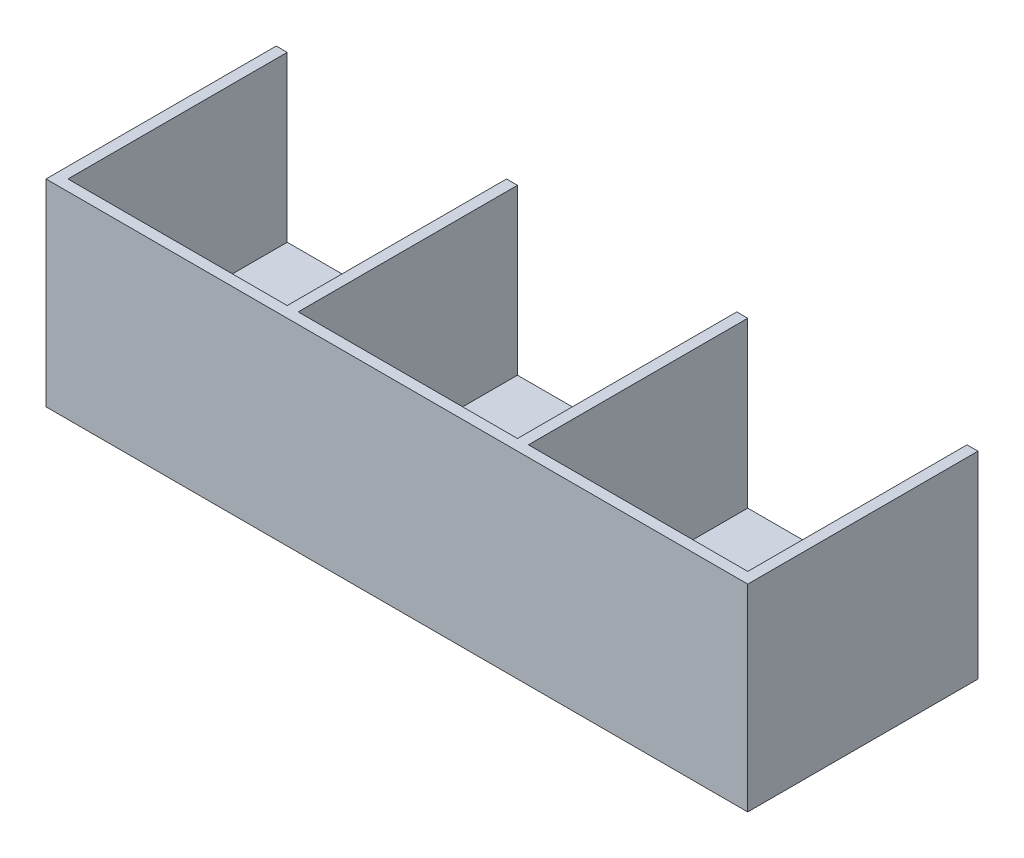
from build123d import *

# Parameters (mm, degrees)
CROQUIS1_W              = 640
CROQUIS1_H              = 220
CROQUIS1_W_2            = 200
CROQUIS1_H_2            = 200
SALIENTE_EXTRUIR1_DEPTH = 150
CROQUIS3_W              = 640
CROQUIS3_H              = 220
SALIENTE_EXTRUIR3_DEPTH = 10
CROQUIS4_R              = 4.626495545
CORTAR_EXTRUIR1_DEPTH   = 371.135110466
CROQUIS5_W              = 640
CROQUIS5_H              = 10
CORTAR_EXTRUIR2_DEPTH   = 375.299345444
CROQUIS6_W              = 640
CROQUIS6_H              = 210
SALIENTE_EXTRUIR4_DEPTH = 20


with BuildPart() as part:
    # Croquis1 → Saliente-Extruir1 (new body)
    with BuildSketch(Plane(origin=(0, 0, 0), x_dir=(1, 0, 0), z_dir=(0, 1, 0))):
        Rectangle(CROQUIS1_W, CROQUIS1_H)
        with Locations((-210, 0)):
            Rectangle(CROQUIS1_W_2, CROQUIS1_H_2, mode=Mode.SUBTRACT)
        Rectangle(CROQUIS1_W_2, CROQUIS1_H_2, mode=Mode.SUBTRACT)
        with Locations((210, 0)):
            Rectangle(CROQUIS1_W_2, CROQUIS1_H_2, mode=Mode.SUBTRACT)
    extrude(amount=SALIENTE_EXTRUIR1_DEPTH)

    # Croquis3 → Saliente-Extruir3 (add)
    with BuildSketch(Plane.XZ):
        Rectangle(CROQUIS3_W, CROQUIS3_H)
    extrude(amount=SALIENTE_EXTRUIR3_DEPTH)

    # Croquis4 → Cortar-Extruir1 (cut, through all)
    with BuildSketch(Plane(origin=(0, 0, 0), x_dir=(1, 0, 0), z_dir=(0, 1, 0))):
        with Locations(Location((-210, 73.450625609, 0), (0, 0, 270))):
            Circle(CROQUIS4_R)
        with Locations(Location((210, 73.450625609, 0), (0, 0, 270))):
            Circle(CROQUIS4_R)
    extrude(amount=-CORTAR_EXTRUIR1_DEPTH, mode=Mode.SUBTRACT)

    # Croquis5 → Cortar-Extruir2 (cut, through all)
    with BuildSketch(Plane(origin=(0, 150, 0), x_dir=(1, 0, 0), z_dir=(0, 1, 0))):
        with Locations((0, 105)):
            Rectangle(CROQUIS5_W, CROQUIS5_H)
    extrude(amount=-CORTAR_EXTRUIR2_DEPTH, mode=Mode.SUBTRACT)

    # Croquis6 → Saliente-Extruir4 (add)
    with BuildSketch(Plane.XZ.offset(10)):
        with Locations((0, 5)):
            Rectangle(CROQUIS6_W, CROQUIS6_H)
    extrude(amount=SALIENTE_EXTRUIR4_DEPTH)


solid = part.part
